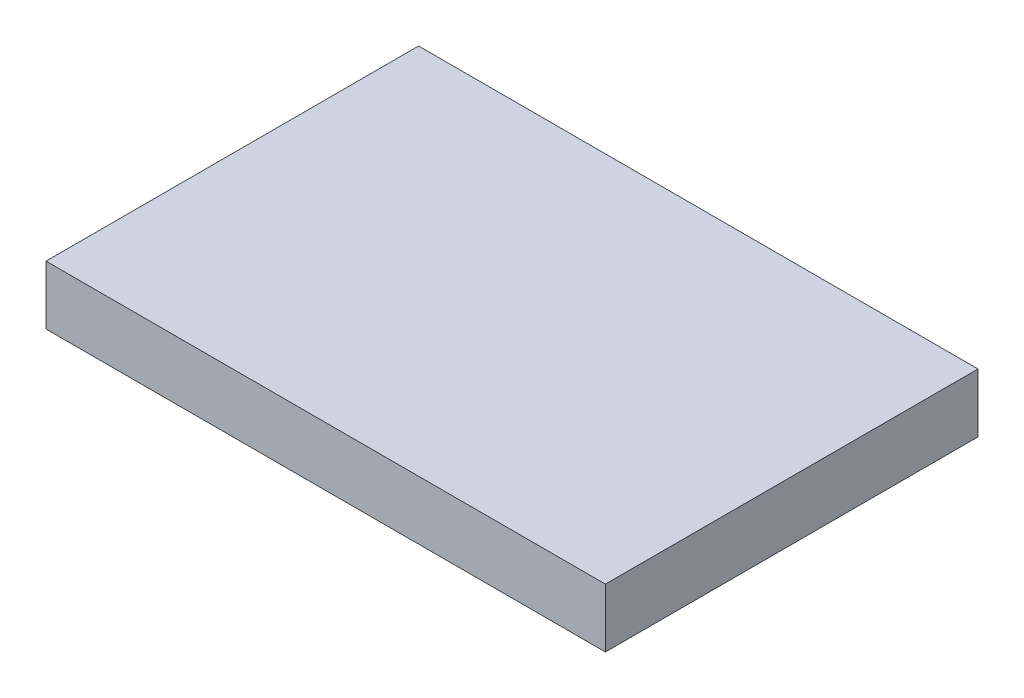
from build123d import *

# Parameters (mm, degrees)
SKETCH1_W           = 33.291154868
SKETCH1_H           = 22.174287082
BOSS_EXTRUDE1_DEPTH = 3.5


with BuildPart() as part:
    # Sketch1 → Boss-Extrude1 (new body)
    with BuildSketch(Plane(origin=(0, 0, 0), x_dir=(1, 0, 0), z_dir=(0, 1, 0))):
        Rectangle(SKETCH1_W, SKETCH1_H)
    extrude(amount=BOSS_EXTRUDE1_DEPTH)


solid = part.part
